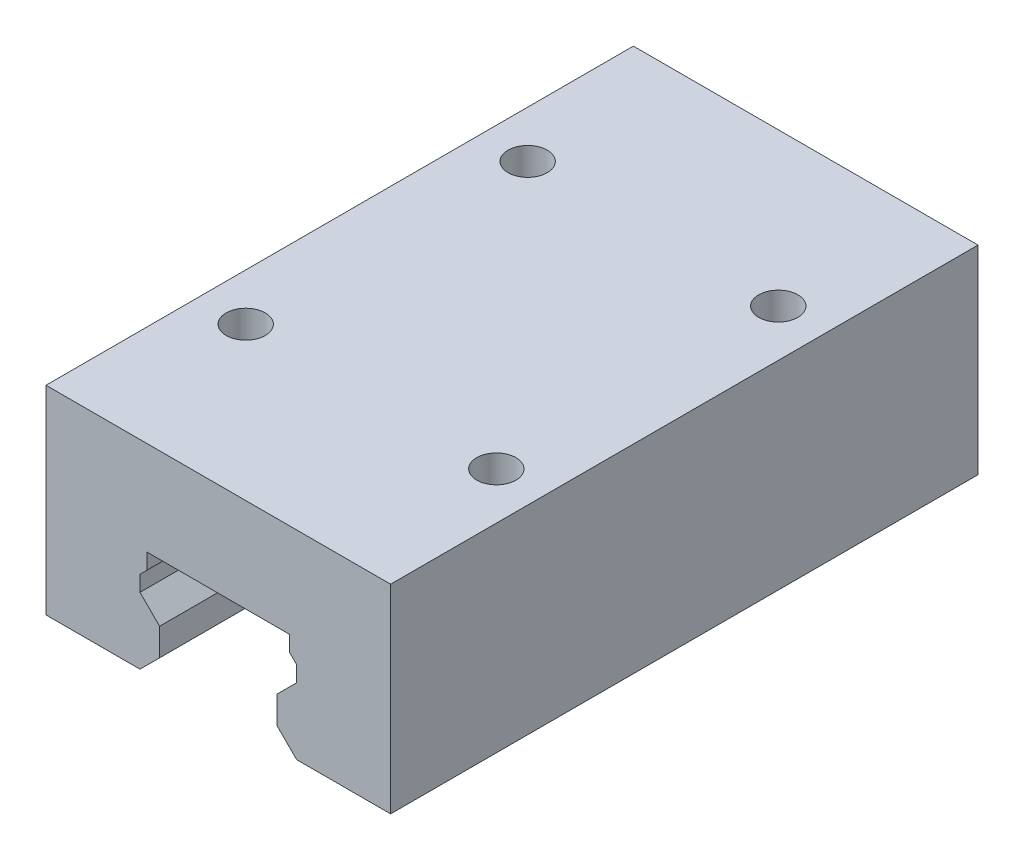
from build123d import *

# Parameters (mm, degrees)
BOSS_EXTRUDE1_DEPTH = 75
SKETCH2_R           = 2.5
CUT_EXTRUDE1_DEPTH  = 6


with BuildPart() as part:
    # Sketch1 → Boss-Extrude1 (new body)
    with BuildSketch(Plane.XY):
        Polygon((-22, 0), (22, 0), (22, -25.4), (10, -25.4), (7.5, -22.9), (7.5, -19.4), (10, -16.9), (10, -14.9), (9.1, -14), (9.1, -12), (-9.1, -12), (-9.1, -14), (-10, -14.9), (-10, -16.9), (-7.5, -19.4), (-7.5, -22.9), (-10, -25.4), (-22, -25.4), align=None)
    extrude(amount=-BOSS_EXTRUDE1_DEPTH)

    # Sketch2 → Cut-Extrude1 (cut)
    with BuildSketch(Plane(origin=(0, 0, 0), x_dir=(1, 0, 0), z_dir=(0, 1, 0))):
        with Locations(Location((-16, 55.5, 0), (0, 0, 270))):
            Circle(SKETCH2_R)
        with Locations(Location((-16, 19.5, 0), (0, 0, 270))):
            Circle(SKETCH2_R)
        with Locations(Location((16, 55.5, 0), (0, 0, 270))):
            Circle(SKETCH2_R)
        with Locations(Location((16, 19.5, 0), (0, 0, 270))):
            Circle(SKETCH2_R)
    extrude(amount=-CUT_EXTRUDE1_DEPTH, mode=Mode.SUBTRACT)


solid = part.part
